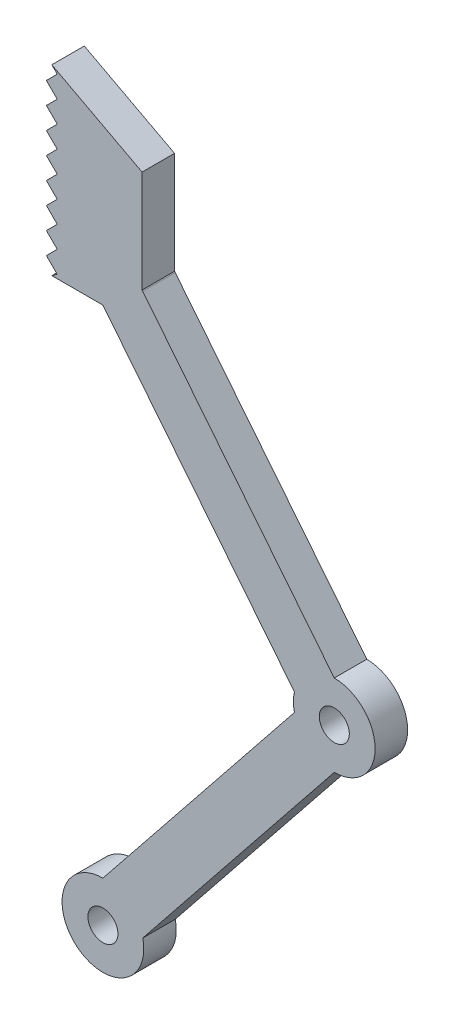
from build123d import *

# Parameters (mm, degrees)
BOSS_EXTRUDE1_DEPTH = 3.18
SKETCH2_R           = 1.47
CUT_EXTRUDE1_DEPTH  = 76.404806599
SKETCH3_R           = 1.47
CUT_EXTRUDE2_DEPTH  = 76.404806599


with BuildPart() as part:
    # Sketch1 → Boss-Extrude1 (new body)
    with BuildSketch(Plane.XY):
        with BuildLine():
            Line((0, 4), (18.75, 27.418742494))
            ThreePointArc((18.75, 27.418742494), (18.653123767, 28.293364452), (18.749834676, 29.168004707))
            Line((18.749834676, 29.168004707), (-0.00459162, 52.583202641))
            Line((-0.00459162, 52.583202641), (-5.00459162, 52.583202641))
            Line((-5.00459162, 52.583202641), (-4.474261534, 52.960989463))
            Line((-4.474261534, 52.960989463), (-5.534921706, 54.021649635))
            Line((-5.534921706, 54.021649635), (-4.474261534, 55.082309806))
            Line((-4.474261534, 55.082309806), (-5.534921706, 56.142969978))
            Line((-5.534921706, 56.142969978), (-4.474261534, 57.20363015))
            Line((-4.474261534, 57.20363015), (-5.534921706, 58.264290322))
            Line((-5.534921706, 58.264290322), (-4.474261534, 59.324950494))
            Line((-4.474261534, 59.324950494), (-5.534921706, 60.385610665))
            Line((-5.534921706, 60.385610665), (-4.474261534, 61.446270837))
            Line((-4.474261534, 61.446270837), (-5.534921706, 62.506931009))
            Line((-5.534921706, 62.506931009), (-4.474261534, 63.567591181))
            Line((-4.474261534, 63.567591181), (-5.534921705, 64.628251353))
            Line((-5.534921705, 64.628251353), (-4.474261534, 65.688911524))
            Line((-4.474261534, 65.688911524), (-5.534921705, 66.749571696))
            Line((-5.534921705, 66.749571696), (-4.474261534, 67.810231868))
            Line((-4.474261534, 67.810231868), (-5.534921705, 68.87089204))
            Line((-5.534921705, 68.87089204), (-4.474261534, 69.931552211))
            Line((-4.474261534, 69.931552211), (-5.00459162, 70.465477027))
            Line((-5.00459162, 70.465477027), (3.831950272, 65.784074737))
            Line((3.831950272, 65.784074737), (3.831950272, 55.784074737))
            Line((3.831950272, 55.784074737), (3.897941369, 55.708940357))
            Line((3.897941369, 55.708940357), (22.652367666, 32.293742423))
            ThreePointArc((22.652367666, 32.293742423), (26.653123731, 28.294120536), (22.653123749, 24.293742494))
            Line((22.653123749, 24.293742494), (3.903123749, 0.875))
            ThreePointArc((3.903123749, 0.875), (-2.5, -3.122498999), (0, 4))
        make_face()
    extrude(amount=BOSS_EXTRUDE1_DEPTH)

    # Sketch2 → Cut-Extrude1 (cut, through all)
    with BuildSketch(Plane(origin=(0, 0, 0), x_dir=(-1, 0, 0), z_dir=(0, 0, -1))):
        with Locations((-22.653123749, 28.293742494)):
            Circle(SKETCH2_R)
    extrude(amount=-CUT_EXTRUDE1_DEPTH, mode=Mode.SUBTRACT)

    # Sketch3 → Cut-Extrude2 (cut, through all)
    with BuildSketch(Plane(origin=(0, 0, 0), x_dir=(-1, 0, 0), z_dir=(0, 0, -1))):
        Circle(SKETCH3_R)
    extrude(amount=-CUT_EXTRUDE2_DEPTH, mode=Mode.SUBTRACT)


solid = part.part
